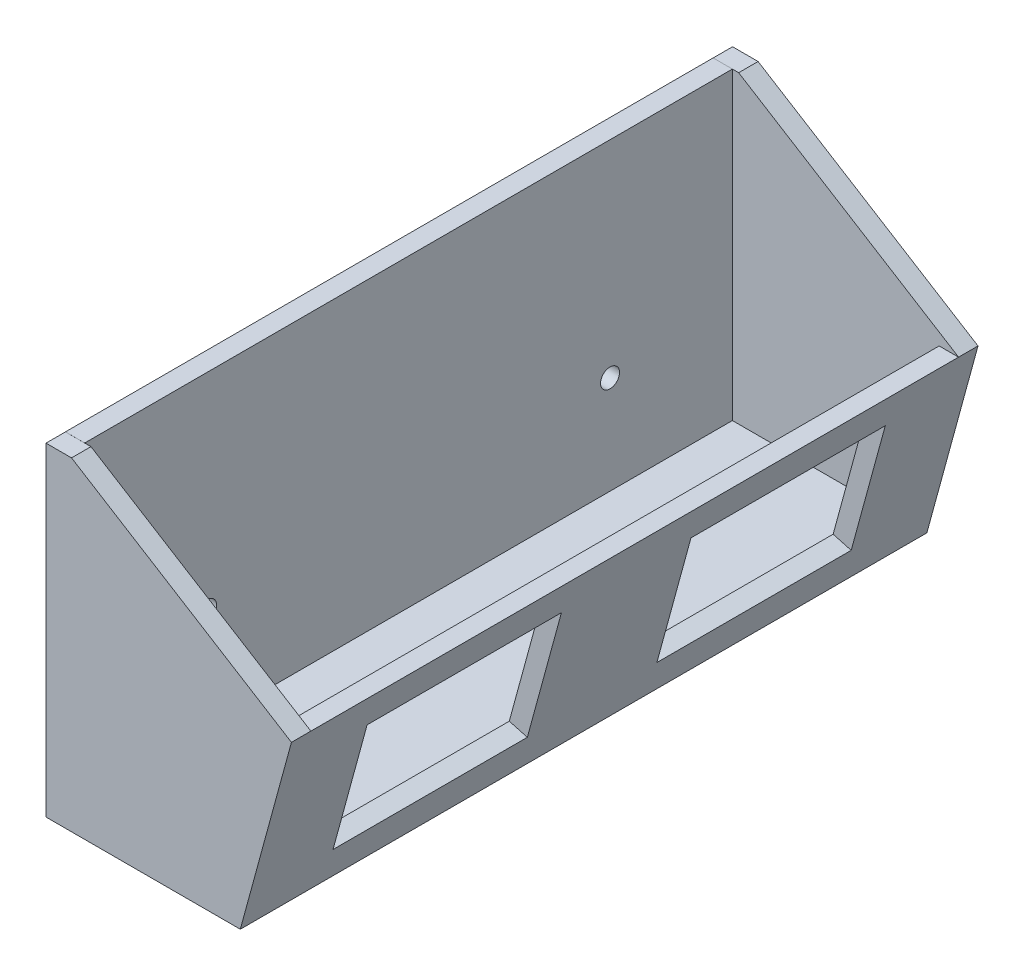
from build123d import *

# Parameters (mm, degrees)
BOSS_EXTRU_1_DEPTH         = 3
BOSS_EXTRU_2_DEPTH         = 100
R_P_TITION_LIN_AIRE1_COUNT = 2
R_P_TITION_LIN_AIRE1_PITCH = 103
ESQUISSE5_W                = 2.97567345
ESQUISSE5_H                = 100
BOSS_EXTRU_3_DEPTH         = 47
ESQUISSE6_W                = 2.99565123
ESQUISSE6_H                = 100
ENL_V_MAT_EXTRU_1_REACH    = 125.839
ESQUISSE7_W                = 30
ESQUISSE7_H                = 20
ESQUISSE9_R                = 1.462141601
ENL_V_MAT_EXTRU_8_DEPTH    = 10


with BuildPart() as part:
    # Esquisse2 → Boss.-Extru.1 (new body)
    with BuildSketch(Plane.XY):
        Polygon((0, 0), (0, 50), (3.942801894, 50), (37.89429856, 28.942702884), (30, 0), align=None)
    boss_extru_1 = extrude(amount=BOSS_EXTRU_1_DEPTH)

    # Esquisse4 → Boss.-Extru.2 (add)
    with BuildSketch(Plane.XY.offset(3)):
        Polygon((0, 0), (0, 3.006117571), (30.819936884, 3.006117571), (30, 0), align=None)
    extrude(amount=BOSS_EXTRU_2_DEPTH)

    # Répétition linéaire1: Boss.-Extru.1 ×2
    with Locations(*[(0, 0, i * R_P_TITION_LIN_AIRE1_PITCH) for i in range(1, R_P_TITION_LIN_AIRE1_COUNT)]):
        add(boss_extru_1)

    # Esquisse5 → Boss.-Extru.3 (add)
    with BuildSketch(Plane(origin=(0, 3.006117571, 0), x_dir=(1, 0, 0), z_dir=(0, 1, 0))):
        with Locations((1.487836725, -53)):
            Rectangle(ESQUISSE5_W, ESQUISSE5_H)
    extrude(amount=BOSS_EXTRU_3_DEPTH)

    # Balayage1: sweep along a curve in space
    with BuildLine() as balayage1_path:
        Line((30.819936884, 3.006117571, 103), (37.89429856, 28.942702884, 103))
    # Esquisse6 → Balayage1 (sweep)
    with BuildSketch(Plane(origin=(0, 3.006117571, 0), x_dir=(1, 0, 0), z_dir=(0, 1, 0))):
        with Locations((29.322111269, -53)):
            Rectangle(ESQUISSE6_W, ESQUISSE6_H)
    sweep(path=balayage1_path.line)

    # Esquisse7 → Enlèv. mat.-Extru.1 (cut, up to next)
    with BuildSketch(Plane(origin=(27.922668341, -7.616077924, 0), x_dir=(0, 0, -1), z_dir=(0.9647567628041306, -0.2631432853479158, 0)), mode=Mode.PRIVATE) as enl_v_mat_extru_1_sk1:
        with Locations((-78, 22.89429856)):
            Rectangle(ESQUISSE7_W, ESQUISSE7_H)
    enl_v_mat_extru_1_tool1 = extrude(enl_v_mat_extru_1_sk1.sketch, amount=-ENL_V_MAT_EXTRU_1_REACH, mode=Mode.PRIVATE) & part.part
    enl_v_mat_extru_1 = enl_v_mat_extru_1_tool1.solids().sort_by_distance((33.947149, 14.471351, 78))[0]
    add(enl_v_mat_extru_1, mode=Mode.SUBTRACT)

    # Symétrie1: Enlèv. mat.-Extru.1 across plane
    add(enl_v_mat_extru_1.mirror(Plane.XY.offset(53)), mode=Mode.SUBTRACT)

    # Esquisse9 → Enlèv. mat.-Extru.8 (cut)
    with BuildSketch(Plane(origin=(2.97567345, 0, 0), x_dir=(0, 0, -1), z_dir=(1, 0, 0))):
        with Locations((-84.107906361, 18.157522719)):
            Circle(ESQUISSE9_R)
    enl_v_mat_extru_8 = extrude(amount=-ENL_V_MAT_EXTRU_8_DEPTH, mode=Mode.SUBTRACT)

    # Symétrie3: Enlèv. mat.-Extru.8 across plane
    add(enl_v_mat_extru_8.mirror(Plane.XY.offset(53)), mode=Mode.SUBTRACT)


solid = part.part
